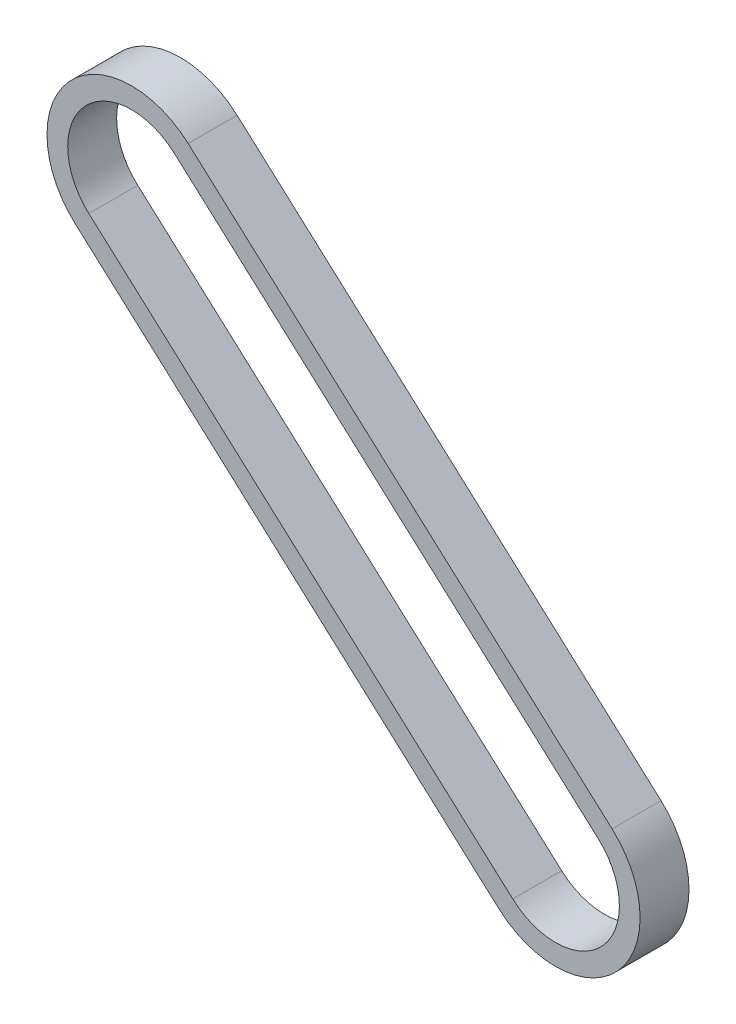
from build123d import *

# Parameters (mm, degrees)
EXTRUDE_THIN1_DEPTH = 4.500000017


with BuildPart() as part:
    # Sketch2 → Extrude-Thin1 (new, symmetric)
    with BuildSketch(Plane.XY):
        with BuildLine():
            Line((-67.580167093, 81.772853172), (10.412201463, 11.567019618))
            ThreePointArc((10.412201463, 11.567019618), (11.567019618, -10.412201463), (-10.412201463, -11.567019618))
            Line((-10.412201463, -11.567019618), (-88.40457002, 58.638813936))
            ThreePointArc((-88.40457002, 58.638813936), (-89.559388174, 80.618035017), (-67.580167093, 81.772853172))
        make_face()
        with BuildLine():
            Line((-70.129177502, 78.9411318), (7.863191054, 8.735298246))
            ThreePointArc((7.863191054, 8.735298246), (8.735298246, -7.863191054), (-7.863191054, -8.735298246))
            Line((-7.863191054, -8.735298246), (-85.85555961, 61.470535308))
            ThreePointArc((-85.85555961, 61.470535308), (-86.727666802, 78.069024607), (-70.129177502, 78.9411318))
        make_face(mode=Mode.SUBTRACT)
    extrude(amount=EXTRUDE_THIN1_DEPTH, both=True)


solid = part.part
